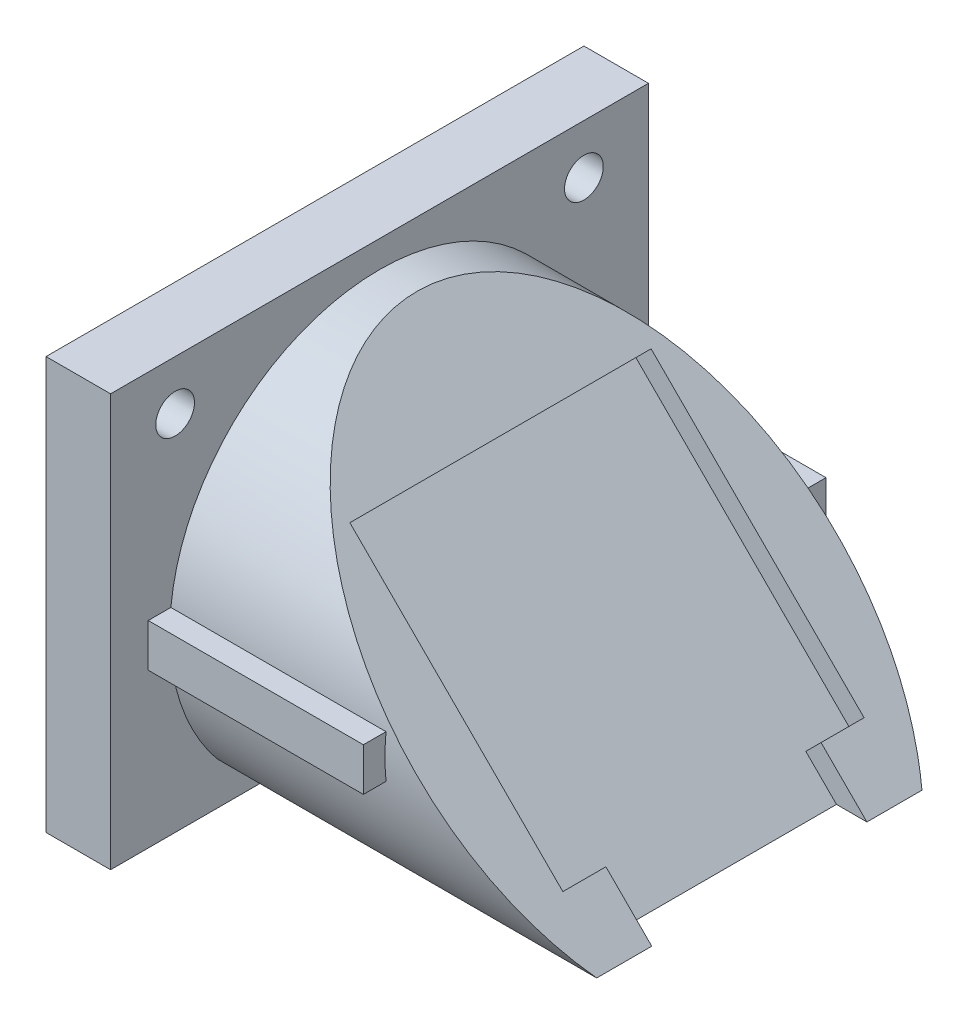
from build123d import *

# Parameters (mm, degrees)
SKETCH_1_W               = 31.418685122
SKETCH_1_H               = 20
EXTRUDE_1_DEPTH          = 20
CUT_EXTRUDE_1_DEPTH      = 40
SKETCH_5_OUTSIDE_W       = 44.348
SKETCH_5_OUTSIDE_H       = 32.93
SKETCH_5_OUTSIDE_R       = 9.75
CUT_EXTRUDE_2_DEPTH      = 45.122368972
CUT_EXTRUDE_3_DEPTH      = 1
SKETCH_6_R               = 9.75
CUT_EXTRUDE_4_DEPTH      = 18.50523648
SKETCH_7_W               = 25
SKETCH_7_H               = 22
EXTRUDE_2_DEPTH          = 3
CUT_EXTRUDE_5_DEPTH      = 25.793531221
CUT_EXTRUDE_5_DEPTH_BACK = 25.793531221
SKETCH_8_W               = 31.739015686
SKETCH_8_H               = 6.741185812
SKETCH_9_W               = 2
SKETCH_9_H               = 2
EXTRUDE_3_DEPTH          = 13
SKETCH_10_W              = 3
SKETCH_10_H              = 25
EXTRUDE_4_DEPTH          = 2
SKETCH_11_R              = 0.75
CUT_EXTRUDE_6_DEPTH      = 4
SKETCH_13_R              = 0.9
CUT_EXTRUDE_7_DEPTH      = 27.529322999


with BuildPart() as part:
    # 草图1 → 凸台-拉伸1 (new, symmetric)
    with BuildSketch(Plane(origin=(0, 0, 0), x_dir=(0, 0, -1), z_dir=(1, 0, 0))):
        Rectangle(SKETCH_1_W, SKETCH_1_H)
    extrude(amount=EXTRUDE_1_DEPTH, both=True)

    # 草图2 → 切除-拉伸1 (cut)
    with BuildSketch(Plane(origin=(0, 0, -15.709342561), x_dir=(-1, 0, 0), z_dir=(0, 0, -1))):
        Polygon((-20, 10), (0, 10), (-20, -10), align=None)
    extrude(amount=-CUT_EXTRUDE_1_DEPTH, mode=Mode.SUBTRACT)

    # 草图5 outside → 切除-拉伸2 (cut, through all)
    with BuildSketch(Plane.ZY.offset(20)):
        Rectangle(SKETCH_5_OUTSIDE_W, SKETCH_5_OUTSIDE_H)
        Circle(SKETCH_5_OUTSIDE_R, mode=Mode.SUBTRACT)
    extrude(amount=-CUT_EXTRUDE_2_DEPTH, mode=Mode.SUBTRACT)

    # 草图3 → 切除-拉伸3 (cut)
    with BuildSketch(Plane(origin=(5, 5, 0), x_dir=(0, 0, -1), z_dir=(0.7071067811865477, 0.7071067811865475, 0))):
        Polygon((-7, -12.765541439), (-5, -12.765541439), (-5, -21.213203436), (5, -21.213203436), (5, -12.765541439), (7, -12.765541439), (7, 1.234458561), (-7, 1.234458561), align=None)
    extrude(amount=-CUT_EXTRUDE_3_DEPTH, mode=Mode.SUBTRACT)

    # 草图6 → 切除-拉伸4 (cut)
    with BuildSketch(Plane.ZY.offset(20)):
        Circle(SKETCH_6_R)
    extrude(amount=-CUT_EXTRUDE_4_DEPTH, mode=Mode.SUBTRACT)

    # 草图7 → 凸台-拉伸2 (add)
    with BuildSketch(Plane.ZY.offset(1.49476352)):
        Rectangle(SKETCH_7_W, SKETCH_7_H)
    extrude(amount=EXTRUDE_2_DEPTH)

    # 草图8 → 切除-拉伸5 (cut, two sides: drawn at the far end of the back side and taken through both)
    with BuildSketch(Plane.XY.offset(-CUT_EXTRUDE_5_DEPTH_BACK)):
        with Locations((7.322399495, -9.529036855)):
            Rectangle(SKETCH_8_W, SKETCH_8_H)
    extrude(amount=CUT_EXTRUDE_5_DEPTH + CUT_EXTRUDE_5_DEPTH_BACK, mode=Mode.SUBTRACT)

    # 草图9 → 凸台-拉伸3 (add)
    with BuildSketch(Plane.ZY.offset(4.49476352)):
        with Locations((-9.75, 0)):
            Rectangle(SKETCH_9_W, SKETCH_9_H)
        with Locations((9.75, 0)):
            Rectangle(SKETCH_9_W, SKETCH_9_H)
    extrude(amount=-EXTRUDE_3_DEPTH)

    # 草图10 → 凸台-拉伸4 (add)
    with BuildSketch(Plane.XZ.offset(6.158443949)):
        with Locations((-2.99476352, 0)):
            Rectangle(SKETCH_10_W, SKETCH_10_H)
    extrude(amount=EXTRUDE_4_DEPTH)

    # 草图11 → 切除-拉伸6 (cut)
    with BuildSketch(Plane.ZY.offset(4.49476352)):
        with Locations((0, 3.720778025)):
            Circle(SKETCH_11_R)
        with Locations((2.3, 1.420778025)):
            Circle(SKETCH_11_R)
        with Locations((0, -0.879221975)):
            Circle(SKETCH_11_R)
        with Locations((-2.3, 1.420778025)):
            Circle(SKETCH_11_R)
    extrude(amount=-CUT_EXTRUDE_6_DEPTH, mode=Mode.SUBTRACT)

    # 草图13 → 切除-拉伸7 (cut, through all)
    with BuildSketch(Plane.ZY.offset(4.49476352)):
        with Locations((-9.5, 8.700986726)):
            Circle(SKETCH_13_R)
        with Locations((9.5, 8.700986726)):
            Circle(SKETCH_13_R)
    extrude(amount=-CUT_EXTRUDE_7_DEPTH, mode=Mode.SUBTRACT)


solid = part.part
